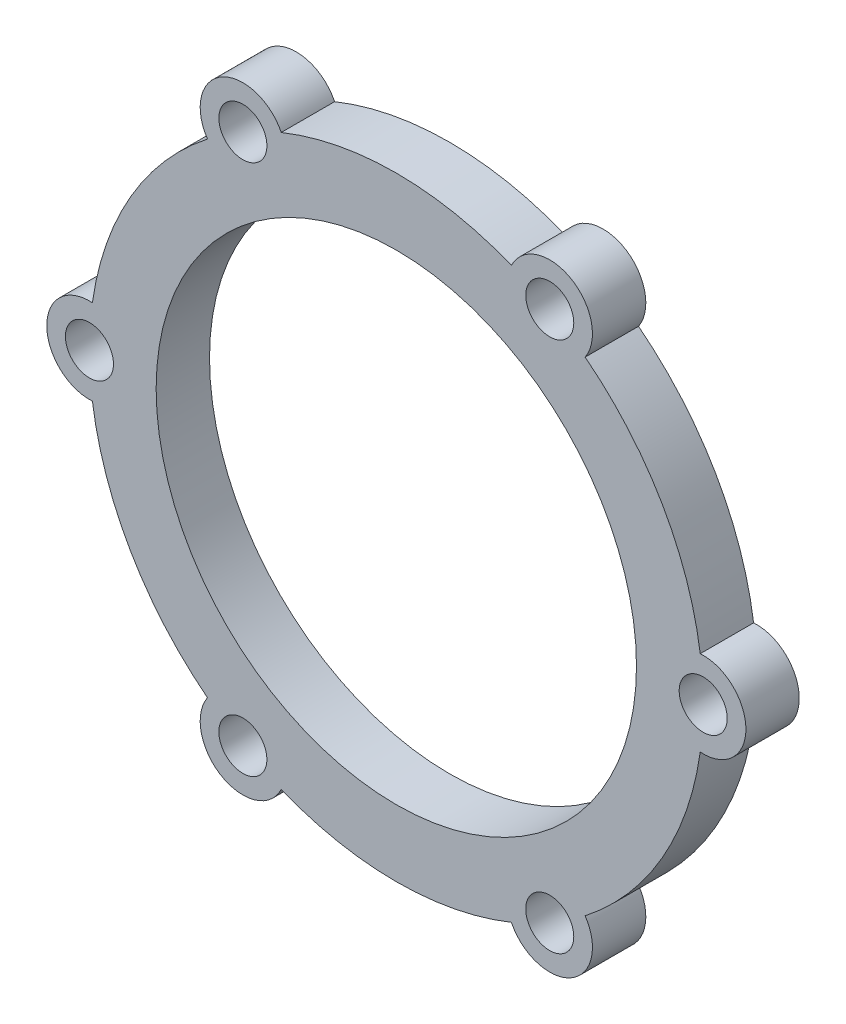
from build123d import *

# Parameters (mm, degrees)
SKETCH1_R           = 4.5
BOSS_EXTRUDE1_DEPTH = 10


with BuildPart() as part:
    # Sketch1 → Boss-Extrude1 (new body)
    # profile 1 of 2: a face of its own
    with BuildSketch(Plane.XY):
        with BuildLine():
            ThreePointArc((-35.383158136, -45.324189131), (-36.54478797, -51.596816377), (-32.75, -56.724663948))
            Line((-32.75, -56.724663948), (-31, -53.693575035))
            ThreePointArc((-31, -53.693575035), (-33.118625566, -50.875863637), (-32.556086083, -47.39568819))
            ThreePointArc((-32.556086083, -47.39568819), (-29.829402919, -45.427835151), (-26.5, -45.899346401))
            Line((-26.5, -45.899346401), (-22.5, -38.97114317))
            ThreePointArc((-22.5, -38.97114317), (-38.97114317, 22.5), (22.5, 38.97114317))
            Line((22.5, 38.97114317), (26.5, 45.899346401))
            ThreePointArc((26.5, 45.899346401), (24.852885683, 52.046460718), (31, 53.693575035))
            Line((31, 53.693575035), (32.75, 56.724663948))
            ThreePointArc((32.75, 56.724663948), (26.411759752, 57.447122947), (21.560320125, 53.304808377))
            ThreePointArc((21.560320125, 53.304808377), (0, 57.5), (-21.560320125, 53.304808377))
            ThreePointArc((-21.560320125, 53.304808377), (-32.75, 56.724663948), (-35.383158136, 45.324189131))
            ThreePointArc((-35.383158136, 45.324189131), (-49.796460718, 28.75), (-56.943478261, 7.980619246))
            ThreePointArc((-56.943478261, 7.980619246), (-65.5, 0), (-56.943478261, -7.980619246))
            ThreePointArc((-56.943478261, -7.980619246), (-49.796460718, -28.75), (-35.383158136, -45.324189131))
        make_face()
        with Locations((-57.5, 0)):
            Circle(SKETCH1_R, mode=Mode.SUBTRACT)
        with Locations((-28.75, 49.796460718)):
            Circle(SKETCH1_R, mode=Mode.SUBTRACT)
    # profile 2 of 2: a face of its own
    with BuildSketch(Plane.XY):
        with BuildLine():
            Line((-31, -53.693575035), (-32.75, -56.724663948))
            ThreePointArc((-32.75, -56.724663948), (-26.411759752, -57.447122947), (-21.560320125, -53.304808377))
            ThreePointArc((-21.560320125, -53.304808377), (0, -57.5), (21.560320125, -53.304808377))
            ThreePointArc((21.560320125, -53.304808377), (32.75, -56.724663948), (35.383158136, -45.324189131))
            ThreePointArc((35.383158136, -45.324189131), (49.796460718, -28.75), (56.943478261, -7.980619246))
            ThreePointArc((56.943478261, -7.980619246), (65.5, 0), (56.943478261, 7.980619246))
            ThreePointArc((56.943478261, 7.980619246), (49.796460718, 28.75), (35.383158136, 45.324189131))
            ThreePointArc((35.383158136, 45.324189131), (36.54478797, 51.596816377), (32.75, 56.724663948))
            Line((32.75, 56.724663948), (31, 53.693575035))
            ThreePointArc((31, 53.693575035), (32.647114317, 52.046460718), (33.25, 49.796460718))
            ThreePointArc((33.25, 49.796460718), (31, 45.899346401), (26.5, 45.899346401))
            Line((26.5, 45.899346401), (22.5, 38.97114317))
            ThreePointArc((22.5, 38.97114317), (38.97114317, 22.5), (45, 0))
            ThreePointArc((45, 0), (22.5, -38.97114317), (-22.5, -38.97114317))
            Line((-22.5, -38.97114317), (-26.5, -45.899346401))
            ThreePointArc((-26.5, -45.899346401), (-24.852885683, -47.546460718), (-24.25, -49.796460718))
            ThreePointArc((-24.25, -49.796460718), (-24.381374434, -50.875863637), (-24.767826961, -51.89224169))
            ThreePointArc((-24.767826961, -51.89224169), (-27.500477566, -54.119502897), (-31, -53.693575035))
        make_face()
        with Locations((28.75, -49.796460718)):
            Circle(SKETCH1_R, mode=Mode.SUBTRACT)
        with Locations((57.5, 0)):
            Circle(SKETCH1_R, mode=Mode.SUBTRACT)
    extrude(amount=BOSS_EXTRUDE1_DEPTH)


solid = part.part
